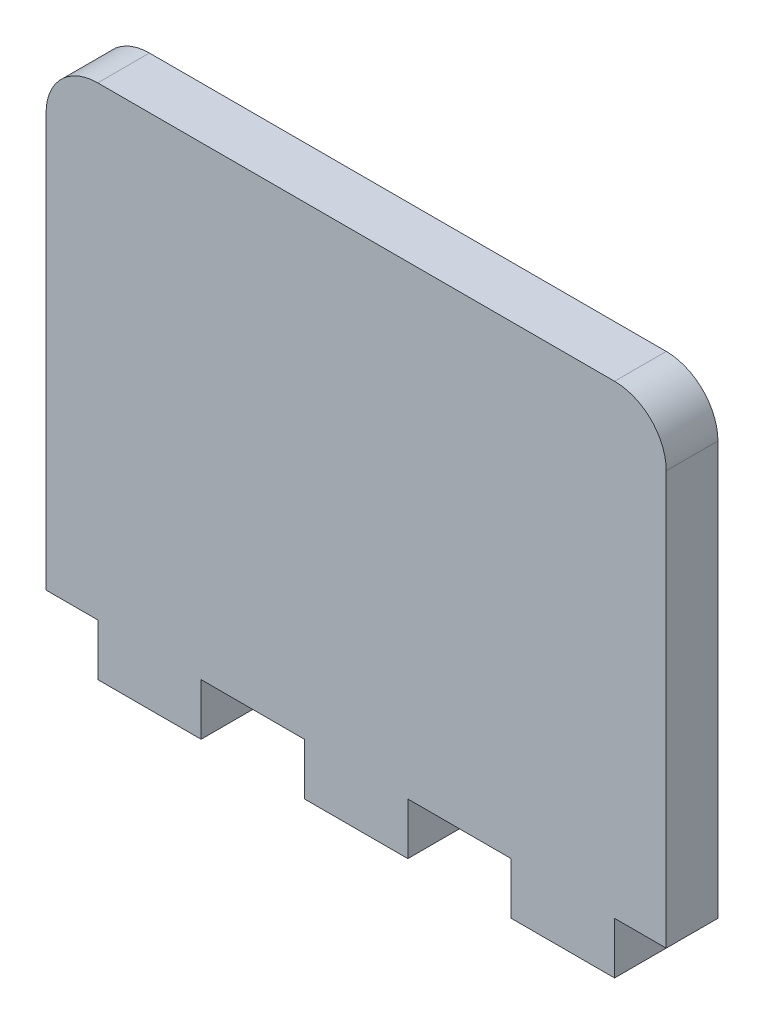
from build123d import *

# Parameters (mm, degrees)
BOSS_EXTRUDE1_DEPTH = 3.175
FILLET1_R           = 3.175


with BuildPart() as part:
    # Sketch1 → Boss-Extrude1 (new body)
    with BuildSketch(Plane.XY):
        Polygon((9.525, 0), (15.875, 0), (15.875, -3.175), (22.225, -3.175), (22.225, 0), (28.575, 0), (28.575, -3.175), (34.925, -3.175), (34.925, 0), (38.1, 0), (38.1, 28.575), (0, 28.575), (0, 0), (3.175, 0), (3.175, -3.175), (9.525, -3.175), align=None)
    extrude(amount=BOSS_EXTRUDE1_DEPTH)

    # Fillet1
    fillet1_edges = [part.edges().sort_by_distance(p)[0] for p in [
        (0, 28.575, 1.5875),
        (38.1, 28.575, 1.5875),
    ]]
    fillet(fillet1_edges, radius=FILLET1_R)


solid = part.part
